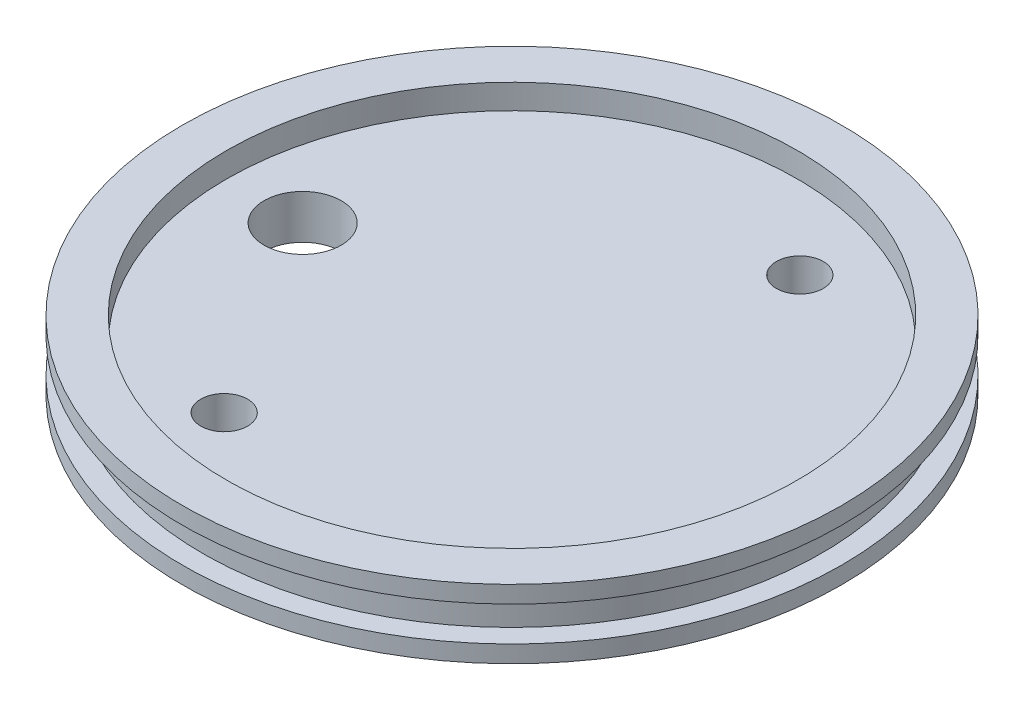
from build123d import *

# Parameters (mm, degrees)
PIPE_TAP_DRILL_FOR_1_4_TAP1_D = 11.1252
F_1_4_CLEARANCE_HOLE1_D       = 6.7564
SKETCH7_R                     = 11.1125
BOSS_EXTRUDE1_DEPTH           = 6.35


with BuildPart() as part:
    # Sketch1 → Revolve1 (revolve)
    with BuildSketch(Plane.XY, mode=Mode.PRIVATE) as revolve1_sk:
        Polygon((0, 0), (47.498, 0), (47.498, 2.4638), (44.577, 2.4638), (44.577, 7.4422), (47.498, 7.4422), (47.498, 9.906), (41.148, 9.906), (41.148, 6.35), (0, 6.35), align=None)
    revolve(revolve1_sk.sketch.rotate(Axis((0, 48.192213231, 0), (0, -1, 0)), 180), axis=Axis((0, 48.192213231, 0), (0, -1, 0)))

    # Pipe Tap Drill for 1/4 Tap1 (through all)
    with Locations(Plane(origin=(0, 6.35, 0), x_dir=(1, 0, 0), z_dir=(0, 1, 0))):
        with Locations((0, 0), (-30.1752, 0)):
            Hole(PIPE_TAP_DRILL_FOR_1_4_TAP1_D / 2)

    # 1/4 Clearance Hole1 (through all)
    with Locations(Plane(origin=(0, 6.35, 0), x_dir=(1, 0, 0), z_dir=(0, 1, 0))):
        with Locations((12.150198978, 29.333175157), (-12.150198978, -29.333175157)):
            Hole(F_1_4_CLEARANCE_HOLE1_D / 2)

    # Sketch7 → Boss-Extrude1 (add)
    with BuildSketch(Plane(origin=(0, 6.35, 0), x_dir=(1, 0, 0), z_dir=(0, 1, 0))):
        Circle(SKETCH7_R)
    extrude(amount=-BOSS_EXTRUDE1_DEPTH)


solid = part.part
